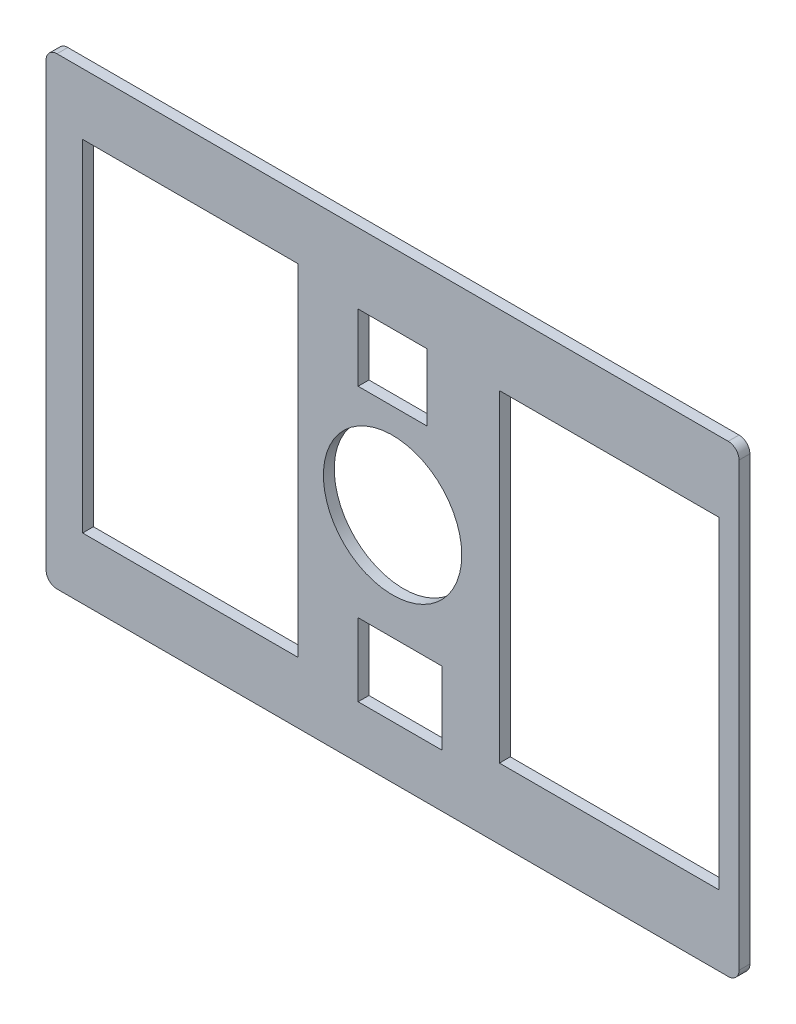
from build123d import *

# Parameters (mm, degrees)
SKETCH1_R           = 12.75
SKETCH1_W           = 39.723964685
SKETCH1_H           = 62.830636574
SKETCH1_W_2         = 40.473473452
SKETCH1_H_2         = 59.45784712
SKETCH1_W_3         = 12.699510432
SKETCH1_H_3         = 12.334572549
SKETCH1_W_4         = 15.426505011
SKETCH1_H_4         = 13.414238347
BOSS_EXTRUDE1_DEPTH = 2


with BuildPart() as part:
    # Sketch1 → Boss-Extrude1 (new body)
    with BuildSketch(Plane.XY):
        with BuildLine():
            Line((61.855, -42.715), (-61.855, -42.715))
            ThreePointArc((-61.855, -42.715), (-63.269213562, -42.129213562), (-63.855, -40.715))
            Line((-63.855, -40.715), (-63.855, 40.715))
            ThreePointArc((-63.855, 40.715), (-63.269213562, 42.129213562), (-61.855, 42.715))
            Line((-61.855, 42.715), (61.855, 42.715))
            ThreePointArc((61.855, 42.715), (63.269213562, 42.129213562), (63.855, 40.715))
            Line((63.855, 40.715), (63.855, -40.715))
            ThreePointArc((63.855, -40.715), (63.269213562, -42.129213562), (61.855, -42.715))
        make_face()
        Circle(SKETCH1_R, mode=Mode.SUBTRACT)
        with Locations((-37.266991881, 0)):
            Rectangle(SKETCH1_W, SKETCH1_H, mode=Mode.SUBTRACT)
        with Locations((39.932411186, 0)):
            Rectangle(SKETCH1_W_2, SKETCH1_H_2, mode=Mode.SUBTRACT)
        with Locations((0, 23.561637286)):
            Rectangle(SKETCH1_W_3, SKETCH1_H_3, mode=Mode.SUBTRACT)
        with Locations((1.36349729, -26.254195002)):
            Rectangle(SKETCH1_W_4, SKETCH1_H_4, mode=Mode.SUBTRACT)
    extrude(amount=BOSS_EXTRUDE1_DEPTH)


solid = part.part
